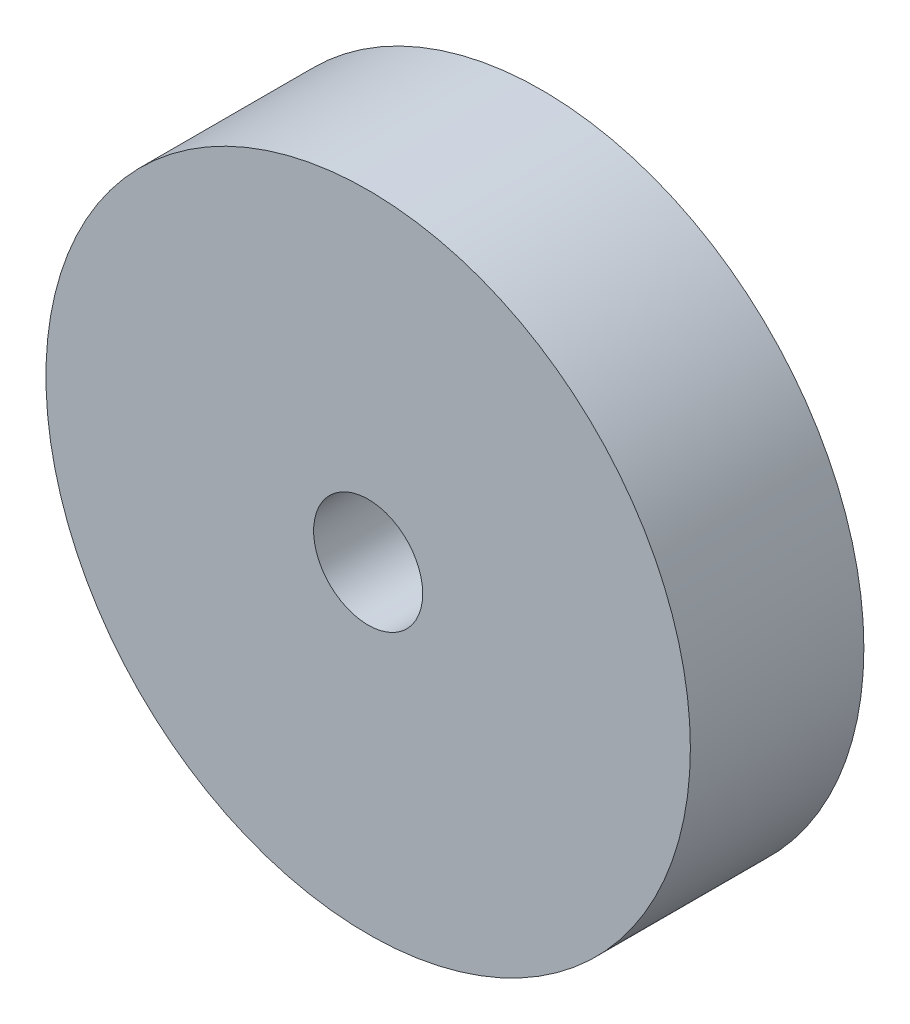
from build123d import *

# Parameters (mm, degrees)
SKETCH1_R           = 13
SKETCH1_R_2         = 1.5
BOSS_EXTRUDE1_DEPTH = 8
SKETCH2_R           = 2.2
CUT_EXTRUDE1_DEPTH  = 10
CUT_EXTRUDE2_DEPTH  = 1


with BuildPart() as part:
    # Sketch1 → Boss-Extrude1 (new body)
    with BuildSketch(Plane.XY):
        with Locations((-59.896810081, 23.108337223)):
            Circle(SKETCH1_R)
        with Locations((-59.896810081, 23.108337223)):
            Circle(SKETCH1_R_2, mode=Mode.SUBTRACT)
    extrude(amount=BOSS_EXTRUDE1_DEPTH)

    # Sketch2 → Cut-Extrude1 (cut)
    with BuildSketch(Plane.XY.offset(8)):
        with Locations((-59.896810081, 23.108337223)):
            Circle(SKETCH2_R)
    extrude(amount=-CUT_EXTRUDE1_DEPTH, mode=Mode.SUBTRACT)

    # Sketch4 → Cut-Extrude2 (cut)
    with BuildSketch(Plane.XY.offset(8)):
        Polygon((-73.325248838, 36.16514022), (-53.384391692, 38.140415901), (-46.517922759, 36.16514022), (-46.517922759, 9.754225618), (-73.325248838, 9.754225618), align=None)
    extrude(amount=-CUT_EXTRUDE2_DEPTH, mode=Mode.SUBTRACT)


solid = part.part
